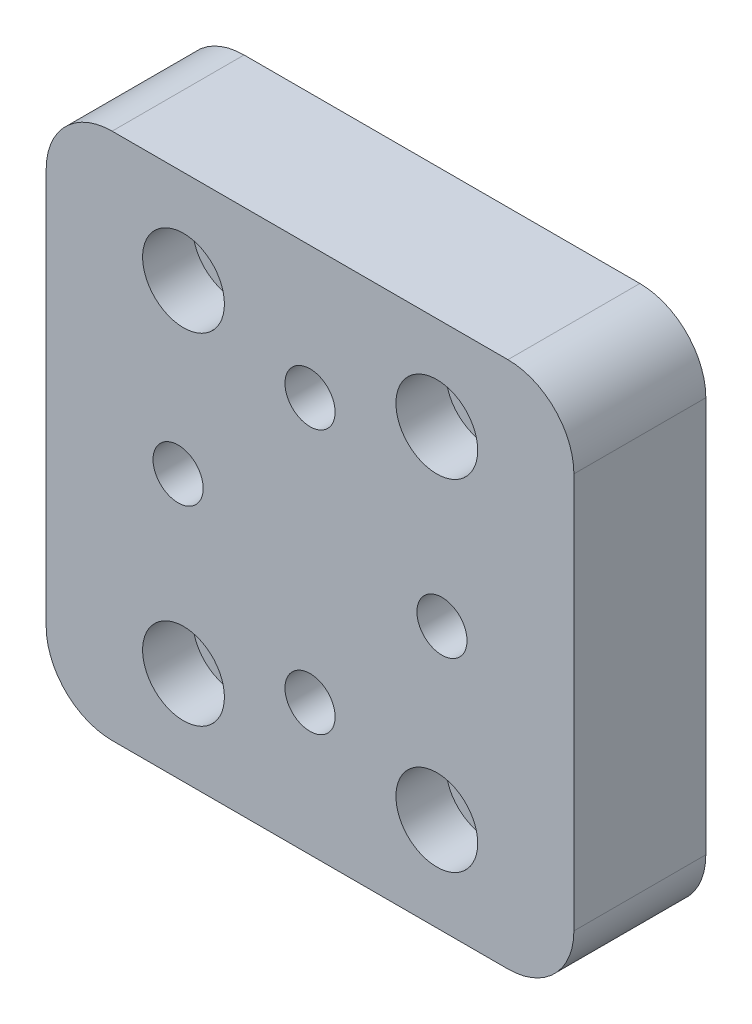
from build123d import *

# Parameters (mm, degrees)
SKETCH1_W           = 50.8
SKETCH1_H           = 50.8
SKETCH1_R           = 2.413
BOSS_EXTRUDE1_DEPTH = 12.7
SKETCH2_R           = 2.413
CUT_EXTRUDE2_DEPTH  = 12.7
SKETCH7_R           = 2.413
CUT_EXTRUDE5_DEPTH  = 6.35
CUT_EXTRUDE6_DEPTH  = 73.955945611
SKETCH13_R          = 3.937
CUT_EXTRUDE7_DEPTH  = 4.826


with BuildPart() as part:
    # Sketch1 → Boss-Extrude1 (new body)
    with BuildSketch(Plane.XY):
        with Locations((25.4, -25.4)):
            Rectangle(SKETCH1_W, SKETCH1_H)
        with Locations((13.219909227, -9.017)):
            Circle(SKETCH1_R, mode=Mode.SUBTRACT)
        with Locations((37.603909227, -9.017)):
            Circle(SKETCH1_R, mode=Mode.SUBTRACT)
        with Locations((13.219909227, -41.783)):
            Circle(SKETCH1_R, mode=Mode.SUBTRACT)
        with Locations((37.603909227, -41.783)):
            Circle(SKETCH1_R, mode=Mode.SUBTRACT)
    extrude(amount=BOSS_EXTRUDE1_DEPTH)

    # Sketch2 → Cut-Extrude2 (cut)
    with BuildSketch(Plane(origin=(0, 0, 0), x_dir=(-1, 0, 0), z_dir=(0, 0, -1))):
        with Locations((-38.1, -25.4)):
            Circle(SKETCH2_R)
        with Locations((-25.4, -12.7)):
            Circle(SKETCH2_R)
        with Locations((-25.4, -38.1)):
            Circle(SKETCH2_R)
        with Locations((-12.7, -25.4)):
            Circle(SKETCH2_R)
    extrude(amount=-CUT_EXTRUDE2_DEPTH, mode=Mode.SUBTRACT)

    # Sketch7 → Cut-Extrude5 (cut)
    # profile 1 of 4: a face of its own
    with BuildSketch(Plane(origin=(0, 0, 0), x_dir=(-1, 0, 0), z_dir=(0, 0, -1))):
        Polygon((-20.6375, -40.849630657), (-20.6375, -35.350369343), (-25.4, -32.600738686), (-30.1625, -35.350369343), (-30.1625, -40.849630657), (-25.4, -43.599261314), align=None)
        with Locations((-25.4, -38.1)):
            Circle(SKETCH7_R, mode=Mode.SUBTRACT)
    # profile 2 of 4: a face of its own
    with BuildSketch(Plane(origin=(0, 0, 0), x_dir=(-1, 0, 0), z_dir=(0, 0, -1))):
        Polygon((-40.849630657, -30.1625), (-35.350369343, -30.1625), (-32.600738686, -25.4), (-35.350369343, -20.6375), (-40.849630657, -20.6375), (-43.599261314, -25.4), align=None)
        with Locations((-38.1, -25.4)):
            Circle(SKETCH7_R, mode=Mode.SUBTRACT)
    # profile 3 of 4: a face of its own
    with BuildSketch(Plane(origin=(0, 0, 0), x_dir=(-1, 0, 0), z_dir=(0, 0, -1))):
        Polygon((-9.950369343, -20.6375), (-15.449630657, -20.6375), (-18.199261314, -25.4), (-15.449630657, -30.1625), (-9.950369343, -30.1625), (-7.200738686, -25.4), align=None)
        with Locations((-12.7, -25.4)):
            Circle(SKETCH7_R, mode=Mode.SUBTRACT)
    # profile 4 of 4: a face of its own
    with BuildSketch(Plane(origin=(0, 0, 0), x_dir=(-1, 0, 0), z_dir=(0, 0, -1))):
        Polygon((-30.1625, -9.950369343), (-30.1625, -15.449630657), (-25.4, -18.199261314), (-20.6375, -15.449630657), (-20.6375, -9.950369343), (-25.4, -7.200738686), align=None)
        with Locations((-25.4, -12.7)):
            Circle(SKETCH7_R, mode=Mode.SUBTRACT)
    extrude(amount=-CUT_EXTRUDE5_DEPTH, mode=Mode.SUBTRACT)

    # Sketch10 → Cut-Extrude6 (cut, through all)
    with BuildSketch(Plane(origin=(0, 0, 0), x_dir=(-1, 0, 0), z_dir=(0, 0, -1))):
        with BuildLine():
            ThreePointArc((-50.8, -6.35), (-48.940128061, -1.859871939), (-44.45, 0))
            Line((-44.45, 0), (-50.8, 0))
            Line((-50.8, 0), (-50.8, -6.35))
        make_face()
        with BuildLine():
            Line((0, 0), (-6.35, 0))
            ThreePointArc((-6.35, 0), (-1.859871939, -1.859871939), (0, -6.35))
            Line((0, -6.35), (0, 0))
        make_face()
        with BuildLine():
            Line((0, -50.8), (0, -44.45))
            ThreePointArc((0, -44.45), (-1.859871939, -48.940128061), (-6.35, -50.8))
            Line((-6.35, -50.8), (0, -50.8))
        make_face()
        with BuildLine():
            ThreePointArc((-50.649504621, -45.824278884), (-50.762264029, -45.141247299), (-50.8, -44.45))
            Line((-50.8, -44.45), (-50.8, -50.8))
            Line((-50.8, -50.8), (-44.45, -50.8))
            ThreePointArc((-44.45, -50.8), (-48.424659047, -49.402230352), (-50.649504621, -45.824278884))
        make_face()
    extrude(amount=-CUT_EXTRUDE6_DEPTH, mode=Mode.SUBTRACT)

    # Sketch13 → Cut-Extrude7 (cut)
    with BuildSketch(Plane.XY.offset(12.7)):
        with Locations((37.603909227, -41.783)):
            Circle(SKETCH13_R)
        with Locations((13.219909227, -41.783)):
            Circle(SKETCH13_R)
        with Locations((37.603909227, -9.017)):
            Circle(SKETCH13_R)
        with Locations((13.219909227, -9.017)):
            Circle(SKETCH13_R)
    extrude(amount=-CUT_EXTRUDE7_DEPTH, mode=Mode.SUBTRACT)


solid = part.part
